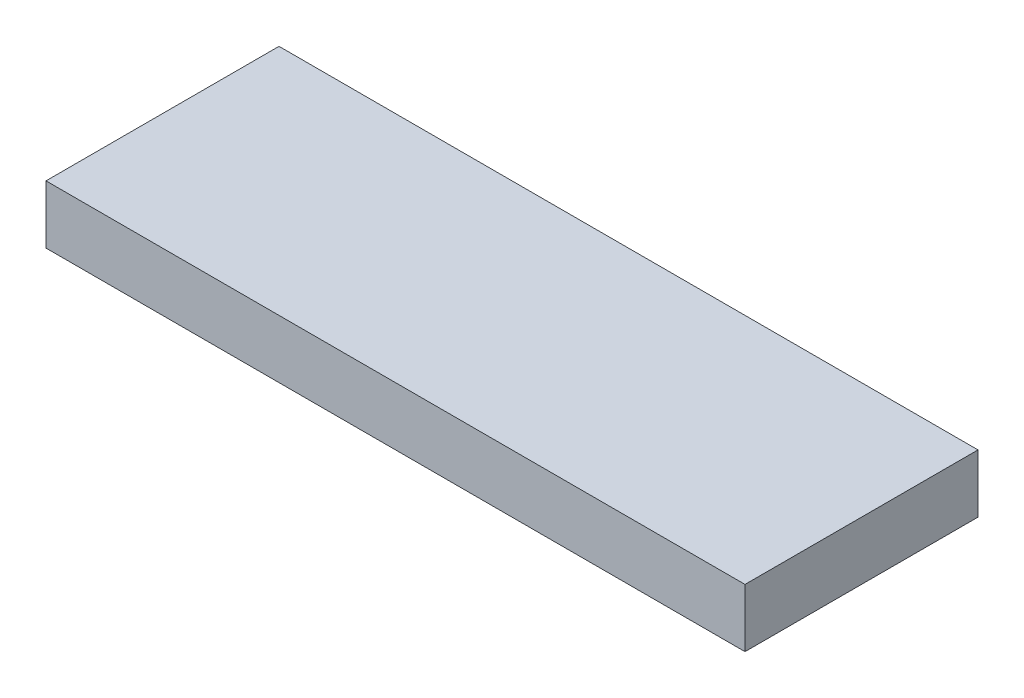
from build123d import *

# Parameters (mm, degrees)
SKETCH2_W           = 76.2
SKETCH2_H           = 25.4
BOSS_EXTRUDE1_DEPTH = 6.35


with BuildPart() as part:
    # Sketch2 → Boss-Extrude1 (new body)
    with BuildSketch(Plane(origin=(0, 0, 0), x_dir=(1, 0, 0), z_dir=(0, 1, 0))):
        with Locations((-18.925490196, -0.124509804)):
            Rectangle(SKETCH2_W, SKETCH2_H)
    extrude(amount=BOSS_EXTRUDE1_DEPTH)


solid = part.part
